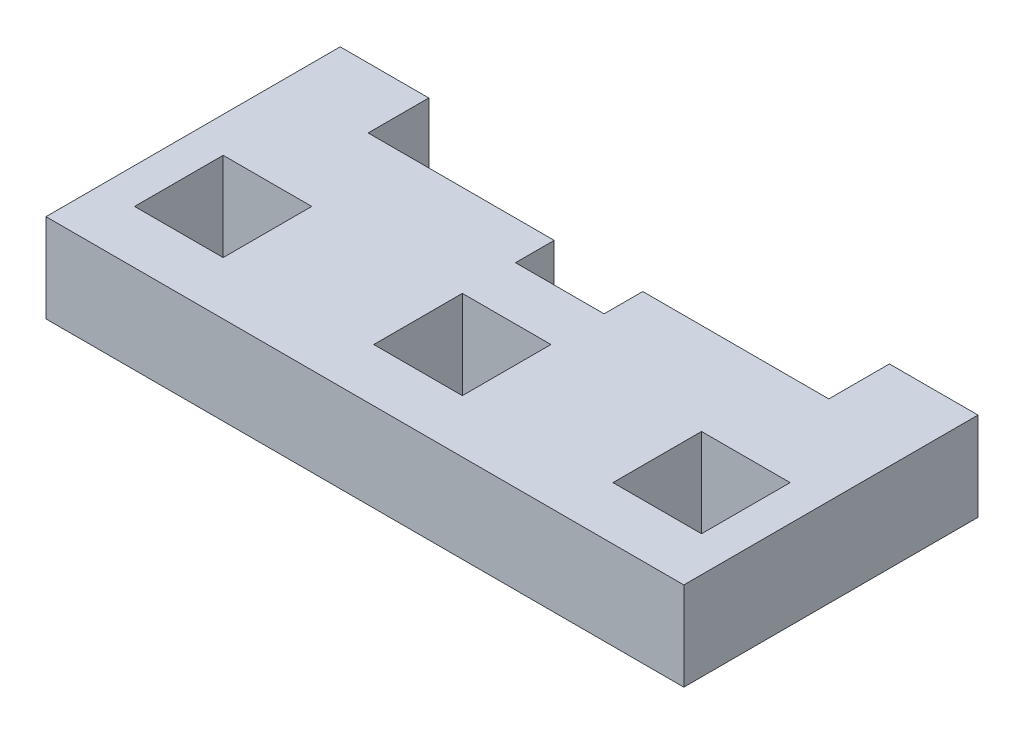
from build123d import *

# Parameters (mm, degrees)
SKETCH1_W           = 6.35
SKETCH1_H           = 6.35
BOSS_EXTRUDE1_DEPTH = 6.35


with BuildPart() as part:
    # Sketch1 → Boss-Extrude1 (new body)
    with BuildSketch(Plane(origin=(0, 0, 0), x_dir=(1, 0, 0), z_dir=(0, 1, 0))):
        Polygon((-22.86, -6.985), (22.86, -6.985), (22.86, 9.757500043), (22.86, 14.102499989), (16.51, 14.102499989), (16.51, 9.757500043), (3.175, 9.757500043), (3.175, 6.985), (-3.175, 6.985), (-3.175, 9.757500043), (-16.51, 9.757500043), (-16.51, 14.102499989), (-22.86, 14.102499989), (-22.86, 9.757500043), align=None)
        Rectangle(SKETCH1_W, SKETCH1_H, mode=Mode.SUBTRACT)
        with Locations((17.145, 0)):
            Rectangle(SKETCH1_W, SKETCH1_H, mode=Mode.SUBTRACT)
        with Locations((-17.145, 0)):
            Rectangle(SKETCH1_W, SKETCH1_H, mode=Mode.SUBTRACT)
    extrude(amount=BOSS_EXTRUDE1_DEPTH)


solid = part.part
